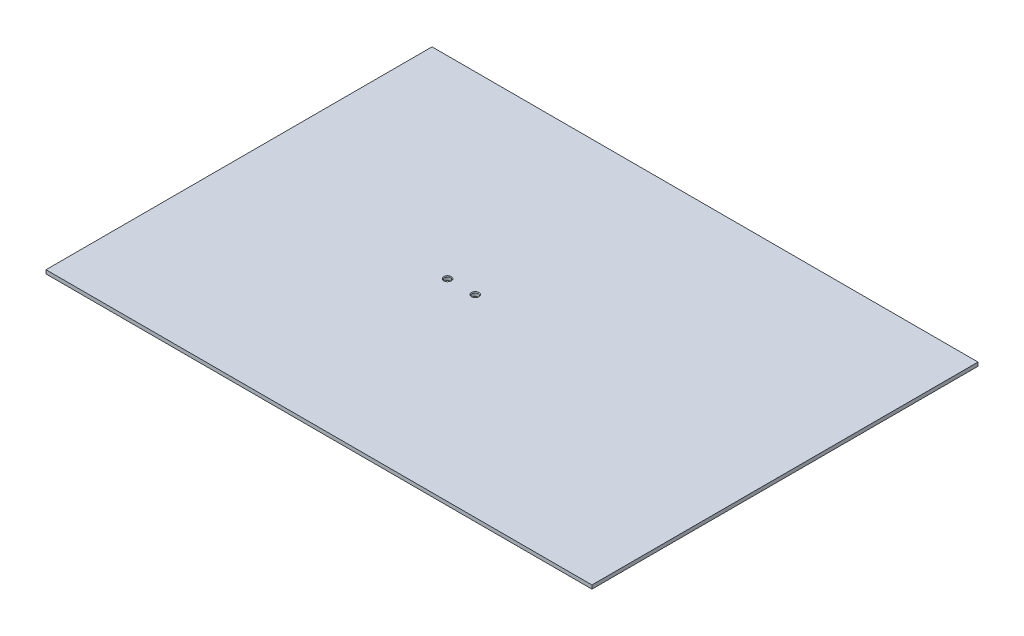
from build123d import *

# Parameters (mm, degrees)
SKETCH1_W                  = 297
SKETCH1_H                  = 210
BOSS_EXTRUDE1_DEPTH        = 2
M4_TAPPED_HOLE1_AT_2_COUNT = 2
M4_TAPPED_HOLE1_AT_2_PITCH = 15


with BuildPart() as part:
    # Sketch1 → Boss-Extrude1 (new body)
    with BuildSketch(Plane(origin=(0, 0, 0), x_dir=(1, 0, 0), z_dir=(0, 1, 0))):
        Rectangle(SKETCH1_W, SKETCH1_H)
    extrude(amount=BOSS_EXTRUDE1_DEPTH)

    # Sketch6 → M4 Tapped Hole1 (revolve, cut)
    with BuildSketch(Plane(origin=(-20, 2, 0), x_dir=(0, 0, 1), z_dir=(1, 0, 0))):
        Polygon((0, 0), (0, 2), (1.65, 2), (1.65, 0.375), (2.025, 0), align=None)
    m4_tapped_hole1 = revolve(axis=Axis((-20, 8.35, 0), (0, -1, 0)), mode=Mode.SUBTRACT)

    # M4 Tapped Hole1 at 2: M4 Tapped Hole1 ×2
    with Locations(*[(-i * M4_TAPPED_HOLE1_AT_2_PITCH, 0, 0) for i in range(1, M4_TAPPED_HOLE1_AT_2_COUNT)]):
        add(m4_tapped_hole1, mode=Mode.SUBTRACT)


solid = part.part
